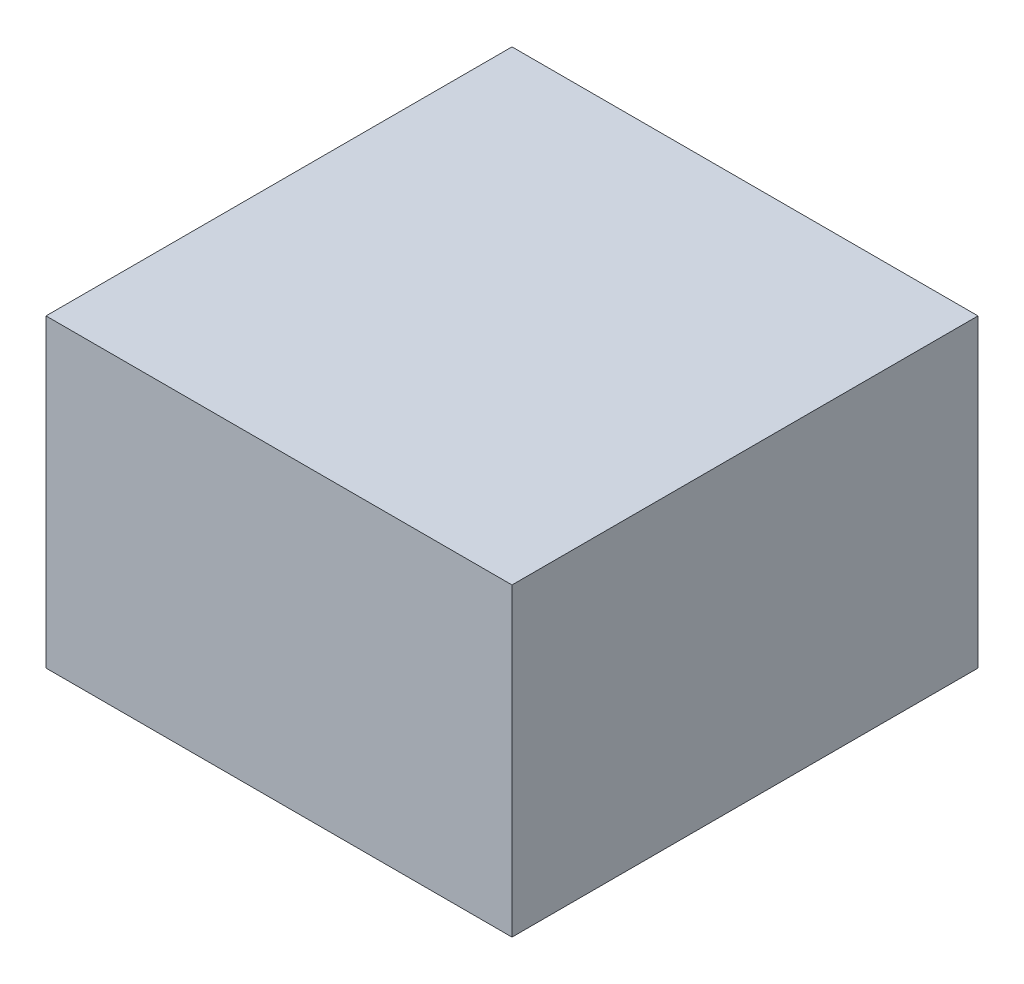
from build123d import *

# Parameters (mm, degrees)
SKETCH1_W           = 550
SKETCH1_H           = 550
BOSS_EXTRUDE1_DEPTH = 360


with BuildPart() as part:
    # Sketch1 → Boss-Extrude1 (new body)
    with BuildSketch(Plane(origin=(0, 0, 0), x_dir=(1, 0, 0), z_dir=(0, 1, 0))):
        Rectangle(SKETCH1_W, SKETCH1_H)
    extrude(amount=BOSS_EXTRUDE1_DEPTH)


solid = part.part
